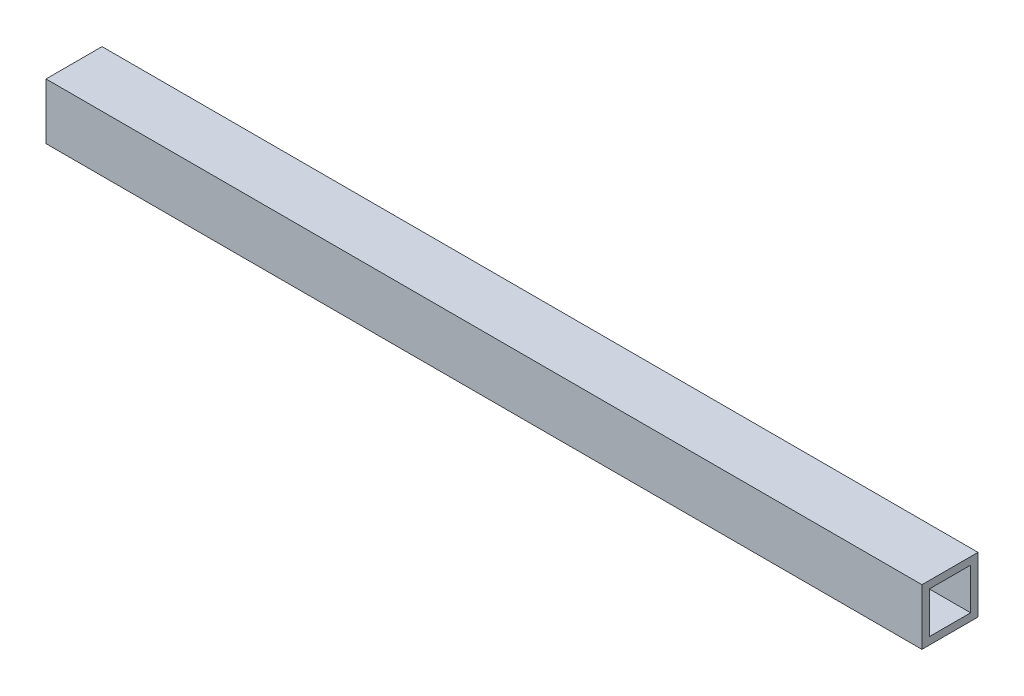
from build123d import *

# Parameters (mm, degrees)
SKETCH1_W           = 38
SKETCH1_H           = 38
SKETCH1_W_2         = 28
SKETCH1_H_2         = 28
BOSS_EXTRUDE1_DEPTH = 594


with BuildPart() as part:
    # Sketch1 → Boss-Extrude1 (new body)
    with BuildSketch(Plane(origin=(0, 0, 0), x_dir=(0, 0, -1), z_dir=(1, 0, 0))):
        with Locations((19, 19)):
            Rectangle(SKETCH1_W, SKETCH1_H)
        with Locations((19, 19)):
            Rectangle(SKETCH1_W_2, SKETCH1_H_2, mode=Mode.SUBTRACT)
    extrude(amount=BOSS_EXTRUDE1_DEPTH)


solid = part.part
